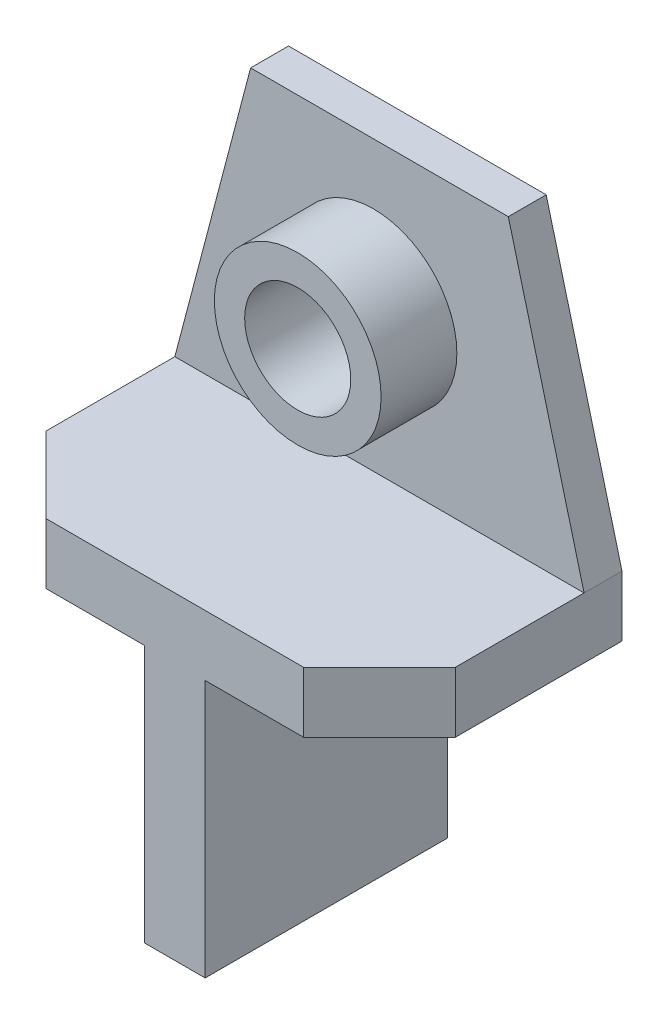
from build123d import *

# Parameters (mm, degrees)
BOSS_EXTRUDE1_DEPTH = 32
CHAMFER3_SIZE       = 10
CHAMFER4_SIZE       = 10
BOSS_EXTRUDE3_DEPTH = 5
SKETCH6_R           = 11
SKETCH6_R_2         = 7
BOSS_EXTRUDE4_DEPTH = 10
CUT_EXTRUDE1_START  = -10
SKETCH7_R           = 7
CUT_EXTRUDE1_DEPTH  = 10


with BuildPart() as part:
    # Sketch2 → Boss-Extrude1 (new body)
    with BuildSketch(Plane.XY):
        Polygon((4.788542225, -32.938228069), (-3.211457775, -32.938228069), (-3.211457775, 1.061771931), (-26.211457775, 1.061771931), (-26.211457775, 9.061771931), (27.788542225, 9.061771931), (27.788542225, 1.061771931), (4.788542225, 1.061771931), align=None)
    extrude(amount=BOSS_EXTRUDE1_DEPTH)

    # Chamfer3
    chamfer3_edges = [part.edges().sort_by_distance(p)[0] for p in [
        (27.788542225, 5.061771931, 32),
    ]]
    chamfer(chamfer3_edges, length=CHAMFER3_SIZE)

    # Chamfer4
    chamfer4_edges = [part.edges().sort_by_distance(p)[0] for p in [
        (-26.211457775, 5.061771931, 32),
    ]]
    chamfer(chamfer4_edges, length=CHAMFER4_SIZE)

    # Sketch5 → Boss-Extrude3 (add)
    with BuildSketch(Plane.XY):
        Polygon((27.788542225, 9.061771931), (17.788542225, 47.061771931), (-16.211457775, 47.061771931), (-26.211457775, 9.061771931), align=None)
    extrude(amount=BOSS_EXTRUDE3_DEPTH)

    # Sketch6 → Boss-Extrude4 (add)
    with BuildSketch(Plane.XY.offset(5)):
        with Locations((0, 28.061771931)):
            Circle(SKETCH6_R)
        with Locations((0, 28.061771931)):
            Circle(SKETCH6_R_2, mode=Mode.SUBTRACT)
    extrude(amount=BOSS_EXTRUDE4_DEPTH)

    # Sketch7 → Cut-Extrude1 (cut)
    with BuildSketch(Plane.XY.offset(5).offset(CUT_EXTRUDE1_START)):
        with Locations(Location((0, 28.061771931, 0), (0, 0, 180))):
            Circle(SKETCH7_R)
    extrude(amount=CUT_EXTRUDE1_DEPTH, mode=Mode.SUBTRACT)


solid = part.part
